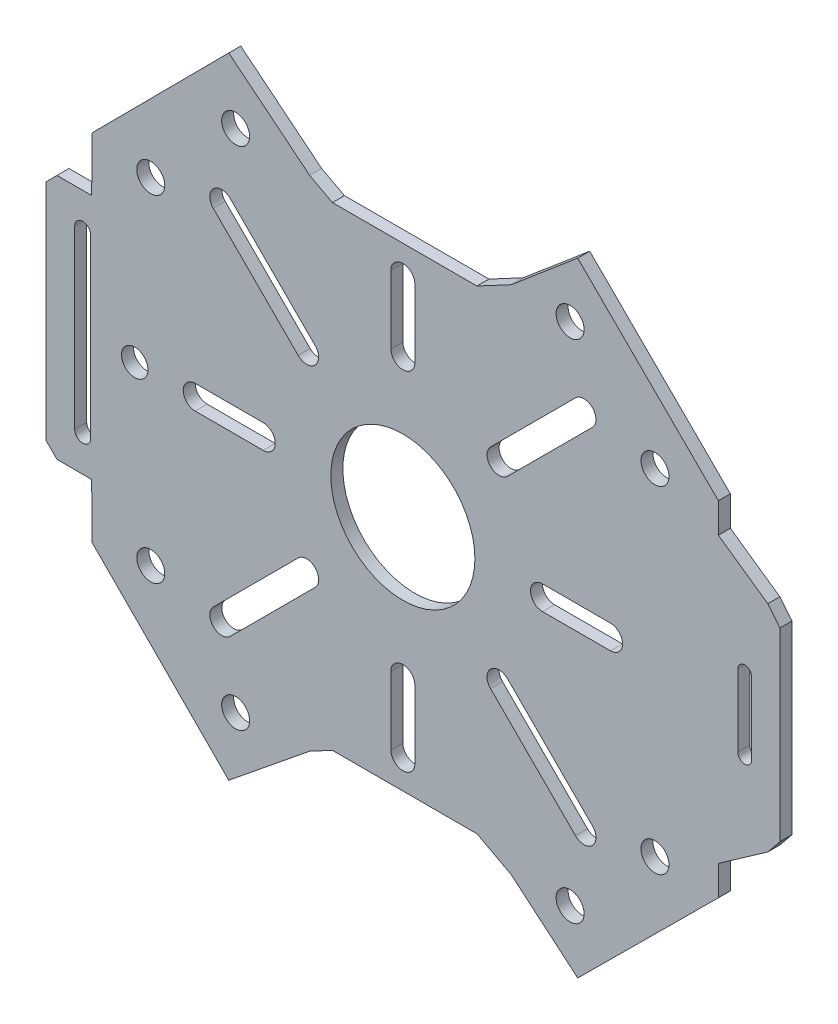
from build123d import *

# Parameters (mm, degrees)
UPPER_BOARD_R   = 9
UPPER_BOARD_R_2 = 1.75
UPPER_BOARD_R_3 = 1.65
EXTRUDE_1_DEPTH = 1.5


with BuildPart() as part:
    # Upper_board → 凸台-拉伸1 (new body)
    with BuildSketch(Plane.XY):
        Polygon((0, 29.63770528), (9.258229776, 29.63770528), (13.530145247, 31.914413679), (21.845237215, 38.947274579), (39.422116781, 21.483203913), (39.422116781, 17.759375685), (45.602672711, 13.431703833), (47.117107925, 11.564161962), (47.117107925, -11.564161962), (45.602672711, -13.431703833), (39.422116781, -17.759375685), (39.422116781, -21.483203913), (21.845237215, -38.947274579), (13.530145247, -31.914413679), (9.258229776, -29.63770528), (0, -29.63770528), (-8.800437365, -29.63770528), (-11.64882797, -31.155749084), (-21.754927214, -39.351031245), (-38.850540354, -22.144989251), (-38.878084859, -15.364158174), (-43.219581062, -15.364158174), (-44.585312397, -13.989604918), (-44.585312397, 13.989604918), (-43.219581062, 15.364158174), (-38.878084859, 15.364158174), (-38.850540354, 22.144989251), (-21.754927214, 39.351031245), (-11.64882797, 31.155749084), (-8.800437365, 29.63770528), align=None)
        Circle(UPPER_BOARD_R, mode=Mode.SUBTRACT)
        with Locations((-20.893398282, 31.606601718)):
            Circle(UPPER_BOARD_R_2, mode=Mode.SUBTRACT)
        with Locations((-31.5, 21)):
            Circle(UPPER_BOARD_R_2, mode=Mode.SUBTRACT)
        with Locations((-33.5, 0)):
            Circle(UPPER_BOARD_R_3, mode=Mode.SUBTRACT)
        with Locations(Location((20.893398282, 31.606601718, 0), (0, 0, 180))):
            Circle(UPPER_BOARD_R_2, mode=Mode.SUBTRACT)
        with Locations(Location((31.5, 21, 0), (0, 0, 180))):
            Circle(UPPER_BOARD_R_2, mode=Mode.SUBTRACT)
        with Locations(Location((-20.893398282, -31.606601718, 0), (0, 0, 180))):
            Circle(UPPER_BOARD_R_2, mode=Mode.SUBTRACT)
        with Locations(Location((-31.5, -21, 0), (0, 0, 180))):
            Circle(UPPER_BOARD_R_2, mode=Mode.SUBTRACT)
        with Locations((20.893398282, -31.606601718)):
            Circle(UPPER_BOARD_R_2, mode=Mode.SUBTRACT)
        with Locations((31.5, -21)):
            Circle(UPPER_BOARD_R_2, mode=Mode.SUBTRACT)
        with BuildLine():
            Line((-21.566327477, 23.687647821), (-10.960584458, 13.081904801))
            ThreePointArc((-10.960584458, 13.081904801), (-10.960584458, 10.960584458), (-13.081904801, 10.960584458))
            Line((-13.081904801, 10.960584458), (-23.687647821, 21.566327477))
            ThreePointArc((-23.687647821, 21.566327477), (-23.687647821, 23.687647821), (-21.566327477, 23.687647821))
        make_face(mode=Mode.SUBTRACT)
        with BuildLine():
            Line((-1.5, 17.445654013), (-1.5, 25.945654013))
            ThreePointArc((-1.5, 25.945654013), (0, 27.445654013), (1.5, 25.945654013))
            Line((1.5, 25.945654013), (1.5, 17.445654013))
            ThreePointArc((1.5, 17.445654013), (0, 15.945654013), (-1.5, 17.445654013))
        make_face(mode=Mode.SUBTRACT)
        with BuildLine():
            Line((-1.5, -17.445654013), (-1.5, -25.945654013))
            ThreePointArc((-1.5, -25.945654013), (0, -27.445654013), (1.5, -25.945654013))
            Line((1.5, -25.945654013), (1.5, -17.445654013))
            ThreePointArc((1.5, -17.445654013), (0, -15.945654013), (-1.5, -17.445654013))
        make_face(mode=Mode.SUBTRACT)
        with BuildLine():
            Line((-17.445654013, 1.5), (-25.945654013, 1.5))
            ThreePointArc((-25.945654013, 1.5), (-27.445654013, 0), (-25.945654013, -1.5))
            Line((-25.945654013, -1.5), (-17.445654013, -1.5))
            ThreePointArc((-17.445654013, -1.5), (-15.945654013, 0), (-17.445654013, 1.5))
        make_face(mode=Mode.SUBTRACT)
        with BuildLine():
            Line((17.445654013, 1.5), (25.945654013, 1.5))
            ThreePointArc((25.945654013, 1.5), (27.445654013, 0), (25.945654013, -1.5))
            Line((25.945654013, -1.5), (17.445654013, -1.5))
            ThreePointArc((17.445654013, -1.5), (15.945654013, 0), (17.445654013, 1.5))
        make_face(mode=Mode.SUBTRACT)
        with BuildLine():
            Line((-21.566327477, -23.687647821), (-10.960584458, -13.081904801))
            ThreePointArc((-10.960584458, -13.081904801), (-10.960584458, -10.960584458), (-13.081904801, -10.960584458))
            Line((-13.081904801, -10.960584458), (-23.687647821, -21.566327477))
            ThreePointArc((-23.687647821, -21.566327477), (-23.687647821, -23.687647821), (-21.566327477, -23.687647821))
        make_face(mode=Mode.SUBTRACT)
        with BuildLine():
            Line((21.566327477, 23.687647821), (10.960584458, 13.081904801))
            ThreePointArc((10.960584458, 13.081904801), (10.960584458, 10.960584458), (13.081904801, 10.960584458))
            Line((13.081904801, 10.960584458), (23.687647821, 21.566327477))
            ThreePointArc((23.687647821, 21.566327477), (23.687647821, 23.687647821), (21.566327477, 23.687647821))
        make_face(mode=Mode.SUBTRACT)
        with BuildLine():
            Line((21.566327477, -23.687647821), (10.960584458, -13.081904801))
            ThreePointArc((10.960584458, -13.081904801), (10.960584458, -10.960584458), (13.081904801, -10.960584458))
            Line((13.081904801, -10.960584458), (23.687647821, -21.566327477))
            ThreePointArc((23.687647821, -21.566327477), (23.687647821, -23.687647821), (21.566327477, -23.687647821))
        make_face(mode=Mode.SUBTRACT)
        with BuildLine():
            Line((-41, -11), (-41, 11))
            ThreePointArc((-41, 11), (-40, 12), (-39, 11))
            Line((-39, 11), (-39, -11))
            ThreePointArc((-39, -11), (-40, -12), (-41, -11))
        make_face(mode=Mode.SUBTRACT)
        with BuildLine():
            Line((41.855351652, -4.5), (41.855351652, 4.5))
            ThreePointArc((41.855351652, 4.5), (42.721395453, 5.366043802), (43.587439255, 4.5))
            Line((43.587439255, 4.5), (43.587439255, -4.5))
            ThreePointArc((43.587439255, -4.5), (42.721395453, -5.366043802), (41.855351652, -4.5))
        make_face(mode=Mode.SUBTRACT)
    extrude(amount=EXTRUDE_1_DEPTH)


solid = part.part
